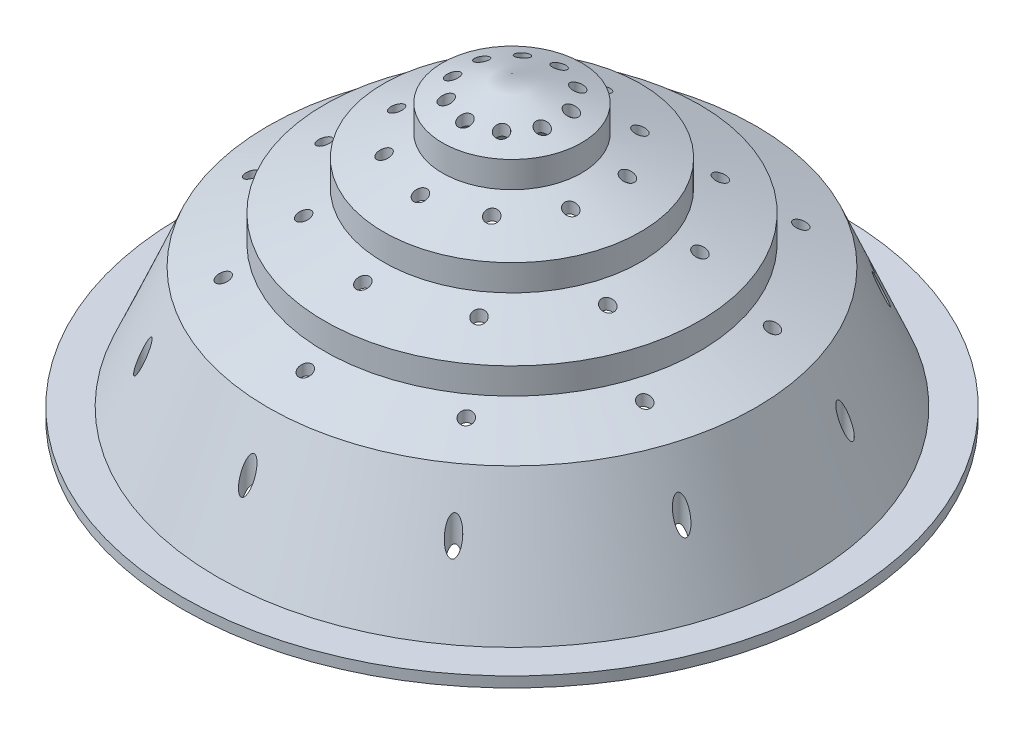
from build123d import *

# Parameters (mm, degrees)
THICKEN1_T2             = 2
CUT_EXTRUDE1_DEPTH      = 106.837842983
CUT_EXTRUDE1_DEPTH_BACK = 106.837842983
SKETCH2_R               = 1.25


with BuildPart() as body_1:
    # Surface-Revolve1: a surface, the sketch's curves turned about an axis
    with BuildLine(Plane(origin=(0, 0, 0), x_dir=(0, 0, -1), z_dir=(1, 0, 0)), mode=Mode.PRIVATE) as surface_revolve1_1_path:
        Line((0, 55), (11.276311449, 50.89575828))
        Line((11.276311449, 50.89575828), (11.276311449, 45.89575828))
        Line((11.276311449, 45.89575828), (22.552622899, 41.79151656))
        Line((22.552622899, 41.79151656), (22.552622899, 36.79151656))
        Line((22.552622899, 36.79151656), (33.828934348, 32.68727484))
        Line((33.828934348, 32.68727484), (33.828934348, 27.68727484))
        Line((33.828934348, 27.68727484), (45.105245798, 23.58303312))
        Line((45.105245798, 23.58303312), (55, 0))
        Line((55, 0), (63, 0))
    surface_revolve1_1 = Shell.revolve(surface_revolve1_1_path.wire(), 360, Axis((0, 0, 0), (0, 1, 0)))
    add(Solid.thicken(surface_revolve1_1, -THICKEN1_T2))

    # Sketch2 → Cut-Extrude1 (cut, two sides: drawn at the far end of the back side and taken through both)
    with BuildSketch(Plane(origin=(0, 0, 0), x_dir=(1, 0, 0), z_dir=(0, 1, 0)).offset(-CUT_EXTRUDE1_DEPTH_BACK)):
        with Locations(Location((0, 9, 0), (0, 0, 90))):
            Circle(SKETCH2_R)
        with Locations(Location((0, 17.5, 0), (0, 0, 89.999999559))):
            Circle(SKETCH2_R)
        with Locations(Location((0, 28.5, 0), (0, 0, 89.99999988))):
            Circle(SKETCH2_R)
        with Locations(Location((0, 39.5, 0), (0, 0, 90.000000066))):
            Circle(SKETCH2_R)
        with Locations(Location((0, 50.5, 0), (0, 0, 111.499261026))):
            Circle(SKETCH2_R)
        with Locations(Location((5.290067271, 7.281152949, 0), (0, 0, 113.010938078))):
            Circle(SKETCH2_R)
        with Locations(Location((10.286241915, 14.157797402, 0), (0, 0, 131.912998088))):
            Circle(SKETCH2_R)
        with Locations(Location((16.75187969, 23.05698434, 0), (0, 0, 120.460167549))):
            Circle(SKETCH2_R)
        with Locations(Location((23.217517466, 31.956171278, 0), (0, 0, 119.012728507))):
            Circle(SKETCH2_R)
        with Locations(Location((29.683155241, 40.855358216, 0), (0, 0, 78.028654962))):
            Circle(SKETCH2_R)
        with Locations(Location((8.559508647, 2.781152949, 0), (0, 0, 128.075765517))):
            Circle(SKETCH2_R)
        with Locations(Location((16.643489035, 5.407797402, 0), (0, 0, 117.72237128))):
            Circle(SKETCH2_R)
        with Locations(Location((27.105110714, 8.80698434, 0), (0, 0, 126.713362323))):
            Circle(SKETCH2_R)
        with Locations(Location((37.566732394, 12.206171278, 0), (0, 0, 114.593999009))):
            Circle(SKETCH2_R)
        with Locations(Location((48.028354073, 15.605358216, 0), (0, 0, 20.191892059))):
            Circle(SKETCH2_R)
        with Locations(Location((8.559508647, -2.781152949, 0), (0, 0, 109.513464299))):
            Circle(SKETCH2_R)
        with Locations(Location((16.643489035, -5.407797402, 0), (0, 0, 129.453348913))):
            Circle(SKETCH2_R)
        with Locations(Location((27.105110714, -8.80698434, 0), (0, 0, 99.844996687))):
            Circle(SKETCH2_R)
        with Locations(Location((37.566732394, -12.206171278, 0), (0, 0, 127.782931203))):
            Circle(SKETCH2_R)
        with Locations(Location((48.028354073, -15.605358216, 0), (0, 0, 345.601484667))):
            Circle(SKETCH2_R)
        with Locations(Location((5.290067271, -7.281152949, 0), (0, 0, 135.528864863))):
            Circle(SKETCH2_R)
        with Locations(Location((10.286241915, -14.157797402, 0), (0, 0, 137.125085579))):
            Circle(SKETCH2_R)
        with Locations(Location((16.75187969, -23.05698434, 0), (0, 0, 137.405613663))):
            Circle(SKETCH2_R)
        with Locations(Location((23.217517466, -31.956171278, 0), (0, 0, 207.708171678))):
            Circle(SKETCH2_R)
        with Locations(Location((29.683155241, -40.855358216, 0), (0, 0, 298.367057597))):
            Circle(SKETCH2_R)
        with Locations(Location((0, -9, 0), (0, 0, 135.536257076))):
            Circle(SKETCH2_R)
        with Locations(Location((0, -17.5, 0), (0, 0, 90))):
            Circle(SKETCH2_R)
        with Locations(Location((0, -28.5, 0), (0, 0, 90.000000011))):
            Circle(SKETCH2_R)
        with Locations(Location((0, -39.5, 0), (0, 0, 90.000000008))):
            Circle(SKETCH2_R)
        with Locations(Location((0, -50.5, 0), (0, 0, 90))):
            Circle(SKETCH2_R)
        with Locations(Location((-5.290067271, -7.281152949, 0), (0, 0, 131.969301631))):
            Circle(SKETCH2_R)
        with Locations(Location((-10.286241915, -14.157797402, 0), (0, 0, 140.189929493))):
            Circle(SKETCH2_R)
        with Locations(Location((-16.75187969, -23.05698434, 0), (0, 0, 141.81480502))):
            Circle(SKETCH2_R)
        with Locations(Location((-23.217517466, -31.956171278, 0), (0, 0, 143.328420771))):
            Circle(SKETCH2_R)
        with Locations(Location((-29.683155241, -40.855358216, 0), (0, 0, 228.661484316))):
            Circle(SKETCH2_R)
        with Locations(Location((-8.559508647, -2.781152949, 0), (0, 0, 146.485332868))):
            Circle(SKETCH2_R)
        with Locations(Location((-16.643489035, -5.407797402, 0), (0, 0, 136.025537017))):
            Circle(SKETCH2_R)
        with Locations(Location((-27.105110714, -8.80698434, 0), (0, 0, 144.109062589))):
            Circle(SKETCH2_R)
        with Locations(Location((-37.566732394, -12.206171278, 0), (0, 0, 134.014536507))):
            Circle(SKETCH2_R)
        with Locations(Location((-48.028354073, -15.605358216, 0), (0, 0, 194.398515332))):
            Circle(SKETCH2_R)
        with Locations(Location((-8.559508647, 2.781152949, 0), (0, 0, 134.377823902))):
            Circle(SKETCH2_R)
        with Locations(Location((-16.643489035, 5.407797402, 0), (0, 0, 145.724506002))):
            Circle(SKETCH2_R)
        with Locations(Location((-27.105110714, 8.80698434, 0), (0, 0, 144.848976732))):
            Circle(SKETCH2_R)
        with Locations(Location((-37.566732394, 12.206171278, 0), (0, 0, 121.524226385))):
            Circle(SKETCH2_R)
        with Locations(Location((-48.028354073, 15.605358216, 0), (0, 0, 157.102087329))):
            Circle(SKETCH2_R)
        with Locations(Location((-5.290067271, 7.281152949, 0), (0, 0, 133.830864678))):
            Circle(SKETCH2_R)
        with Locations(Location((-10.286241915, 14.157797402, 0), (0, 0, 133.554007739))):
            Circle(SKETCH2_R)
        with Locations(Location((-16.75187969, 23.05698434, 0), (0, 0, 133.231643794))):
            Circle(SKETCH2_R)
        with Locations(Location((-23.217517466, 31.956171278, 0), (0, 0, 133.243734825))):
            Circle(SKETCH2_R)
        with Locations(Location((-29.683155241, 40.855358216, 0), (0, 0, 100.430608762))):
            Circle(SKETCH2_R)
    extrude(amount=CUT_EXTRUDE1_DEPTH + CUT_EXTRUDE1_DEPTH_BACK, mode=Mode.SUBTRACT)


solid = body_1.part
